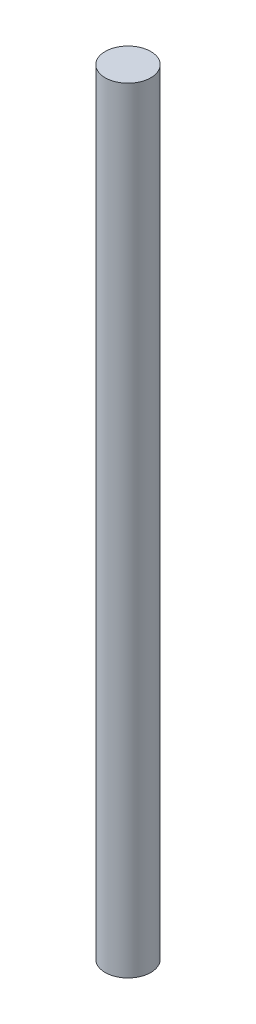
from build123d import *

# Parameters (mm, degrees)
SKETCH1_R           = 10
BOSS_EXTRUDE1_DEPTH = 340


with BuildPart() as part:
    # Sketch1 → Boss-Extrude1 (new body)
    with BuildSketch(Plane(origin=(0, 0, 0), x_dir=(1, 0, 0), z_dir=(0, 1, 0))):
        with Locations(Location((-105.403121309, -22.864525467, 0), (0, 0, 270))):
            Circle(SKETCH1_R)
    extrude(amount=BOSS_EXTRUDE1_DEPTH)


solid = part.part
